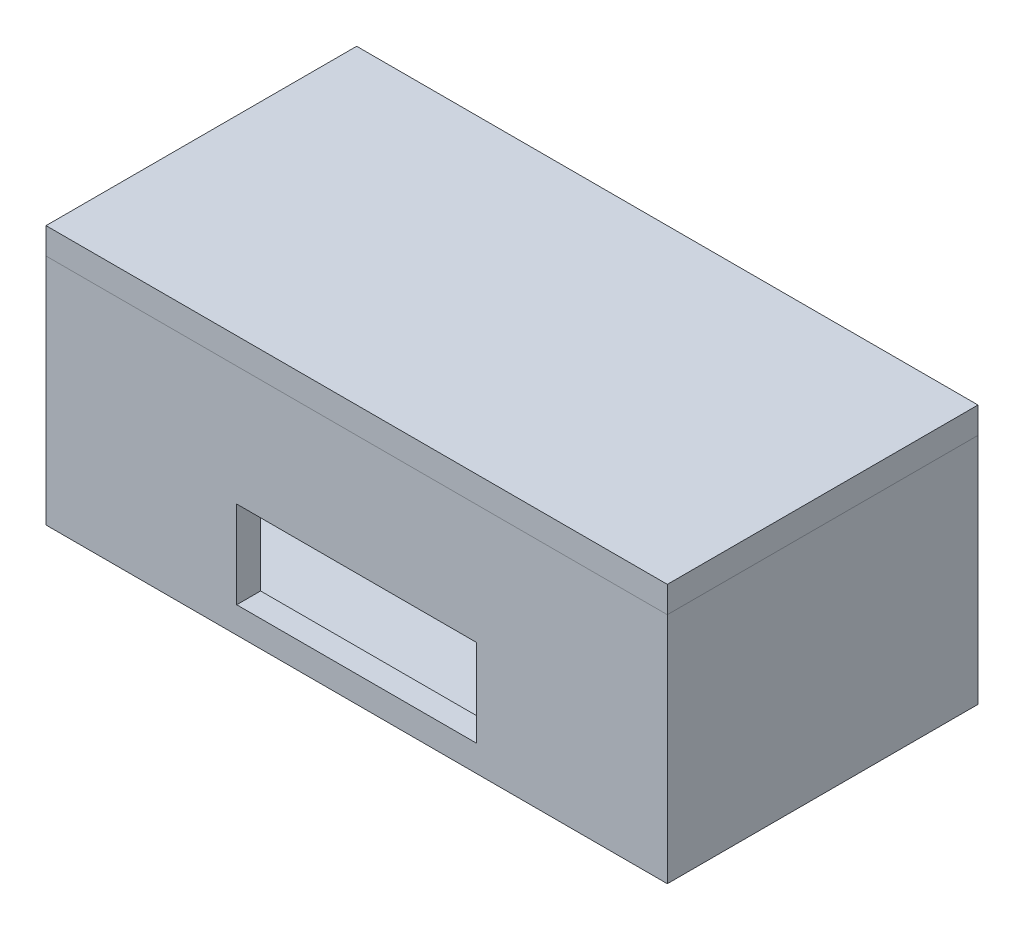
from build123d import *

# Parameters (mm, degrees)
CROQUIS1_W              = 130
CROQUIS1_H              = 65
SALIENTE_EXTRUIR1_DEPTH = 48.75
VACIADO1_T              = -5
CROQUIS2_W              = 130
CROQUIS2_H              = 65
CROQUIS2_W_2            = 120
CROQUIS2_H_2            = 55
CROQUIS2_W_3            = 119
CROQUIS2_H_3            = 54
SALIENTE_EXTRUIR2_DEPTH = 5.5
CROQUIS2_4_W            = 119
CROQUIS2_4_H            = 54
SALIENTE_EXTRUIR3_DEPTH = 5.5
CROQUIS3_W              = 50.2
CROQUIS3_H              = 18.26
CORTAR_EXTRUIR1_DEPTH   = 5


with BuildPart() as part:
    # Croquis1 → Saliente-Extruir1 (new body)
    with BuildSketch(Plane(origin=(0, 0, 0), x_dir=(1, 0, 0), z_dir=(0, 1, 0))):
        Rectangle(CROQUIS1_W, CROQUIS1_H)
    extrude(amount=SALIENTE_EXTRUIR1_DEPTH)

    # Vaciado1
    vaciado1_openings = [part.faces().sort_by_distance(p)[0] for p in [
        (0, 48.75, 0),
    ]]
    offset(amount=VACIADO1_T, openings=vaciado1_openings, kind=Kind.INTERSECTION)

    # Croquis3 → Cortar-Extruir1 (cut)
    with BuildSketch(Plane.XY.offset(32.5)):
        with Locations((0, 14.63)):
            Rectangle(CROQUIS3_W, CROQUIS3_H)
    extrude(amount=-CORTAR_EXTRUIR1_DEPTH, mode=Mode.SUBTRACT)


with BuildPart() as body_2:
    # Croquis2 → Saliente-Extruir2 (new body)
    # profile 1 of 3: a face of its own
    with BuildSketch(Plane(origin=(0, 48.75, 0), x_dir=(1, 0, 0), z_dir=(0, 1, 0))):
        Rectangle(CROQUIS2_W, CROQUIS2_H)
        Rectangle(CROQUIS2_W_2, CROQUIS2_H_2, mode=Mode.SUBTRACT)
    # profile 2 of 3: a face of its own
    with BuildSketch(Plane(origin=(0, 48.75, 0), x_dir=(1, 0, 0), z_dir=(0, 1, 0))):
        Rectangle(CROQUIS2_W_2, CROQUIS2_H_2)
        Rectangle(CROQUIS2_W_3, CROQUIS2_H_3, mode=Mode.SUBTRACT)
    # profile 3 of 3: a face of its own
    with BuildSketch(Plane(origin=(0, 48.75, 0), x_dir=(1, 0, 0), z_dir=(0, 1, 0))):
        Rectangle(CROQUIS2_W_3, CROQUIS2_H_3)
    extrude(amount=SALIENTE_EXTRUIR2_DEPTH)

    # Croquis2<4> → Saliente-Extruir3 (add)
    with BuildSketch(Plane(origin=(0, 48.75, 0), x_dir=(1, 0, 0), z_dir=(0, 1, 0))):
        Rectangle(CROQUIS2_4_W, CROQUIS2_4_H)
    extrude(amount=-SALIENTE_EXTRUIR3_DEPTH)


solid = Compound([part.part, body_2.part])
